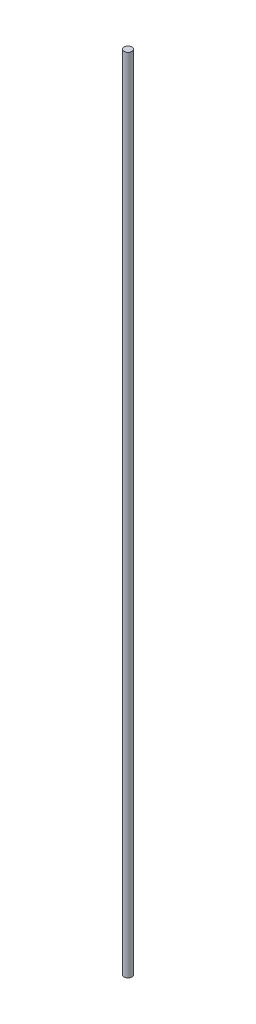
from build123d import *

# Parameters (mm, degrees)
SKETCH1_R           = 4
BOSS_EXTRUDE1_DEPTH = 822.96


with BuildPart() as part:
    # Sketch1 → Boss-Extrude1 (new body)
    with BuildSketch(Plane(origin=(0, 0, 0), x_dir=(1, 0, 0), z_dir=(0, 1, 0))):
        with Locations(Location((0, 0, 0), (0, 0, 270))):
            Circle(SKETCH1_R)
    extrude(amount=BOSS_EXTRUDE1_DEPTH)


solid = part.part
